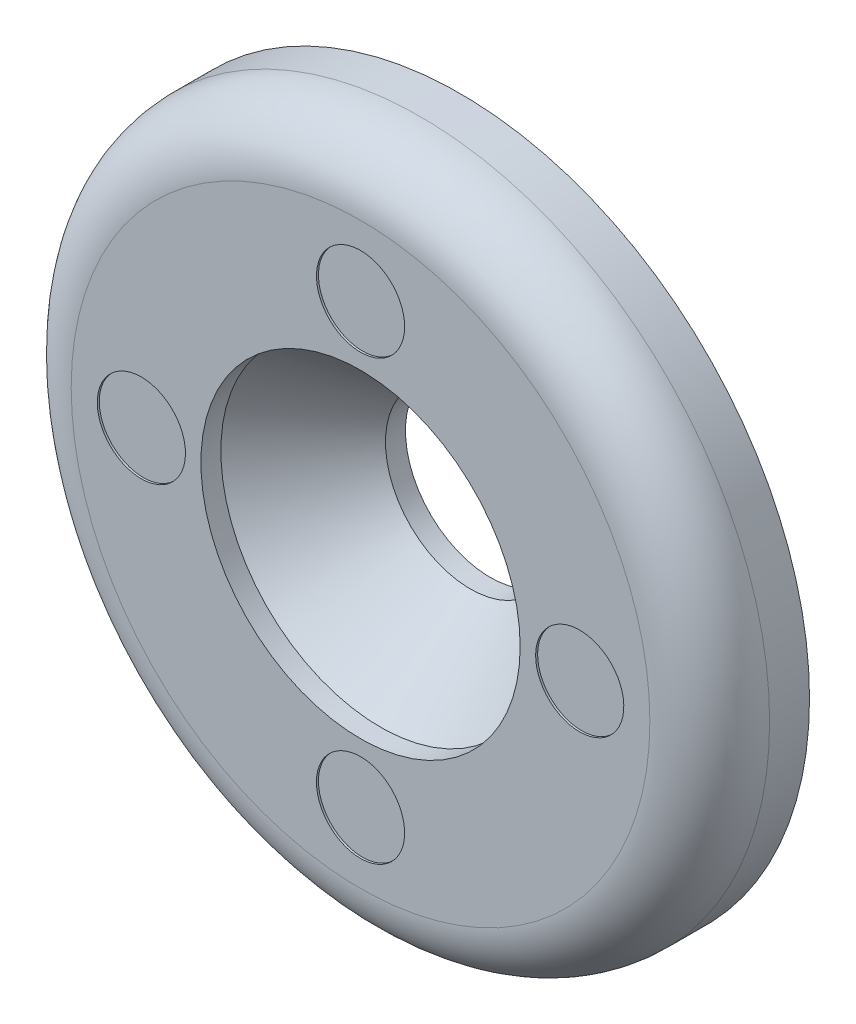
from build123d import *

# Parameters (mm, degrees)
FILETE1_R             = 3
ESBO_O2_R             = 2.209069454
CORTE_EXTRUS_O1_DEPTH = 0.1
PADR_OCIRCULAR1_COUNT = 4
FILETE2_R             = 1


with BuildPart() as part:
    # Esboço1 → Revolução1 (revolve)
    with BuildSketch(Plane(origin=(0, 0, 0), x_dir=(0, 0, -1), z_dir=(1, 0, 0)), mode=Mode.PRIVATE) as revolu_o1_sk:
        Polygon((6.5, 4.25), (6.5, 8.25), (5, 9.5), (5, 17.5), (0, 17.5), (0, 8), (1, 8), (5.5, 4.25), align=None)
    revolve(revolu_o1_sk.sketch.rotate(Axis((0, 0, 0), (0, 0, -1)), 90), axis=Axis((0, 0, 0), (0, 0, -1)))

    # Filete1
    filete1_edges = [part.edges().sort_by_distance(p)[0] for p in [
        (-17.5, 0, 0),
    ]]
    fillet(filete1_edges, radius=FILETE1_R)

    # Esboço2 → Corte-extrusão1 (cut)
    with BuildSketch(Plane.XY):
        with Locations((0, 10.983322756)):
            Circle(ESBO_O2_R)
    corte_extrus_o1 = extrude(amount=-CORTE_EXTRUS_O1_DEPTH, mode=Mode.SUBTRACT)

    # PadrãoCircular1: Corte-extrusão1 ×4 about axis
    padr_ocircular1_axis = Axis((0, 0, 0), (0, 0, 1))
    for i in range(1, PADR_OCIRCULAR1_COUNT):
        add(corte_extrus_o1.rotate(padr_ocircular1_axis, i * 360 / PADR_OCIRCULAR1_COUNT), mode=Mode.SUBTRACT)

    # Filete2
    filete2_edges = [part.edges().sort_by_distance(p)[0] for p in [
        (-9.5, 0, -5),
        (-8.25, 0, -6.5),
    ]]
    fillet(filete2_edges, radius=FILETE2_R)


solid = part.part
